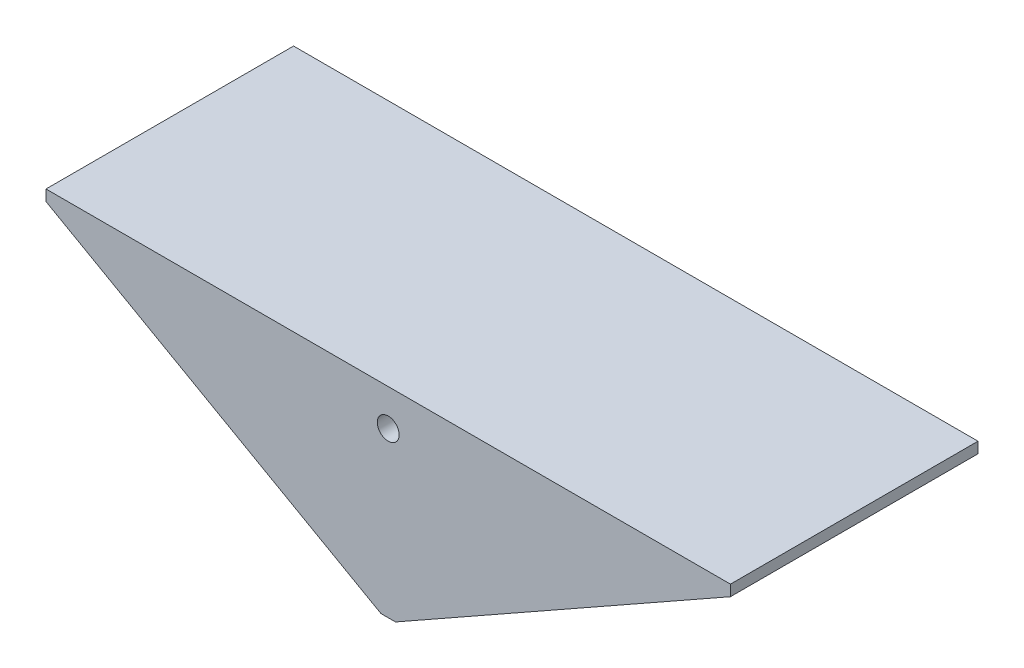
from build123d import *

# Parameters (mm, degrees)
SKETCH_1_W          = 94
SKETCH_1_H          = 34
EXTRUDE_1_DEPTH     = 2.5
SKETCH_2_W          = 94
SKETCH_2_H          = 34
SKETCH_2_W_2        = 44
SKETCH_2_H_2        = 30
EXTRUDE_2_DEPTH     = 25
CUT_EXTRUDE_1_DEPTH = 104.038827633
SKETCH_7_R          = 5
EXTRUDE_4_DEPTH     = 34
SKETCH_8_R          = 1.5
CUT_EXTRUDE_2_DEPTH = 104.038827633


with BuildPart() as part:
    # 草图1 → 凸台-拉伸1 (new body)
    with BuildSketch(Plane(origin=(0, 0, 0), x_dir=(1, 0, 0), z_dir=(0, 1, 0))):
        with Locations((47, 17)):
            Rectangle(SKETCH_1_W, SKETCH_1_H)
    extrude(amount=EXTRUDE_1_DEPTH)

    # 草图2 → 凸台-拉伸2 (add)
    with BuildSketch(Plane(origin=(0, 0, 0), x_dir=(-1, 0, 0), z_dir=(0, -1, 0))):
        with Locations((-47, 17)):
            Rectangle(SKETCH_2_W, SKETCH_2_H)
        with Locations((-24, 17)):
            Rectangle(SKETCH_2_W_2, SKETCH_2_H_2, mode=Mode.SUBTRACT)
        with Locations((-70, 17)):
            Rectangle(SKETCH_2_W_2, SKETCH_2_H_2, mode=Mode.SUBTRACT)
    extrude(amount=EXTRUDE_2_DEPTH)

    # 草图6 → 切除-拉伸1 (cut, through all)
    with BuildSketch(Plane(origin=(0, 0, -34), x_dir=(-1, 0, 0), z_dir=(0, 0, -1))):
        Polygon((0, -25), (0, 1), (-46, -25), align=None)
        Polygon((-94, -25), (-94, 1), (-48, -25), align=None)
    extrude(amount=-CUT_EXTRUDE_1_DEPTH, mode=Mode.SUBTRACT)

    # 草图7 → 凸台-拉伸4 (add)
    with BuildSketch(Plane(origin=(0, 0, -34), x_dir=(-1, 0, 0), z_dir=(0, 0, -1))):
        with Locations((-47, -2.5)):
            Circle(SKETCH_7_R)
    extrude(amount=-EXTRUDE_4_DEPTH)

    # 草图8 → 切除-拉伸2 (cut, through all)
    with BuildSketch(Plane(origin=(0, 0, -34), x_dir=(-1, 0, 0), z_dir=(0, 0, -1))):
        with Locations((-47, -2.5)):
            Circle(SKETCH_8_R)
    extrude(amount=-CUT_EXTRUDE_2_DEPTH, mode=Mode.SUBTRACT)


solid = part.part
